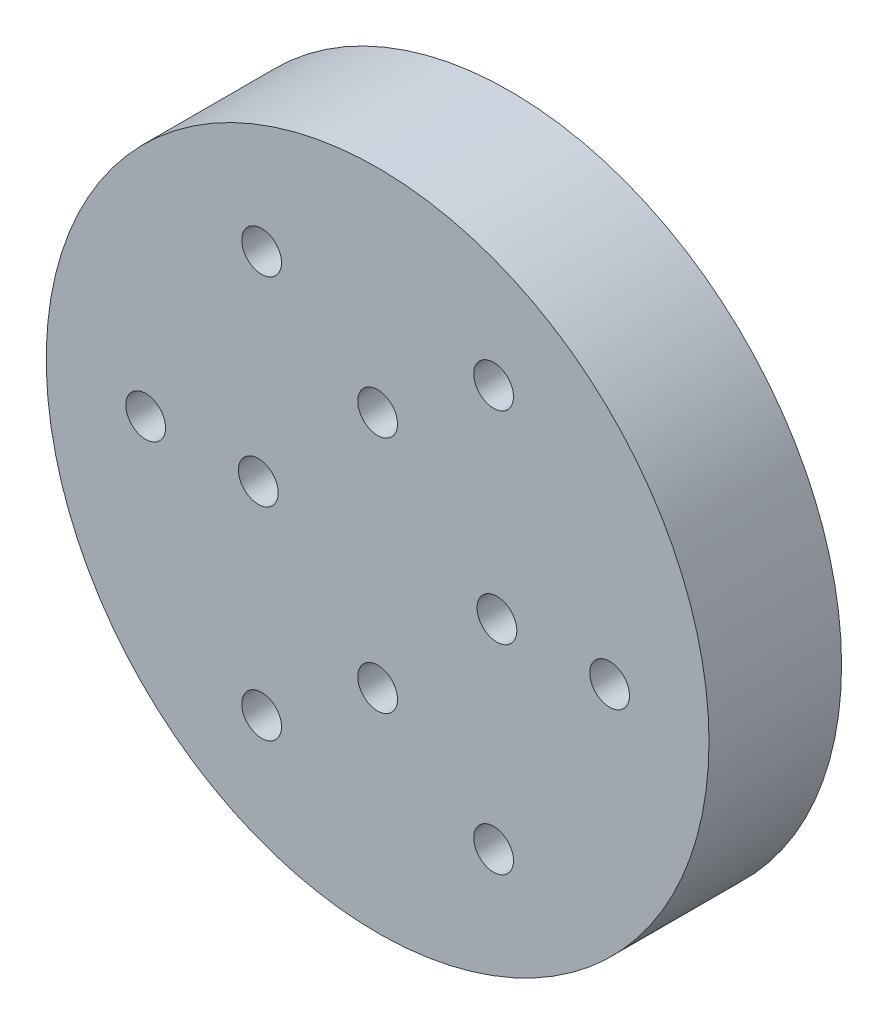
from build123d import *

# Parameters (mm, degrees)
SKETCH_1_R      = 50
SKETCH_1_R_2    = 3
EXTRUDE_1_DEPTH = 20


with BuildPart() as part:
    # 草图1 → 凸台-拉伸1 (new body)
    with BuildSketch(Plane.XY):
        Circle(SKETCH_1_R)
        with Locations((-18, 0)):
            Circle(SKETCH_1_R_2, mode=Mode.SUBTRACT)
        with Locations((0, 18)):
            Circle(SKETCH_1_R_2, mode=Mode.SUBTRACT)
        with Locations((18, 0)):
            Circle(SKETCH_1_R_2, mode=Mode.SUBTRACT)
        with Locations((0, -18)):
            Circle(SKETCH_1_R_2, mode=Mode.SUBTRACT)
        with Locations((-35, 0)):
            Circle(SKETCH_1_R_2, mode=Mode.SUBTRACT)
        with Locations((-17.5, 30.310889132)):
            Circle(SKETCH_1_R_2, mode=Mode.SUBTRACT)
        with Locations((17.5, 30.310889132)):
            Circle(SKETCH_1_R_2, mode=Mode.SUBTRACT)
        with Locations((35, 0)):
            Circle(SKETCH_1_R_2, mode=Mode.SUBTRACT)
        with Locations((17.5, -30.310889132)):
            Circle(SKETCH_1_R_2, mode=Mode.SUBTRACT)
        with Locations((-17.5, -30.310889132)):
            Circle(SKETCH_1_R_2, mode=Mode.SUBTRACT)
    extrude(amount=EXTRUDE_1_DEPTH)


solid = part.part
